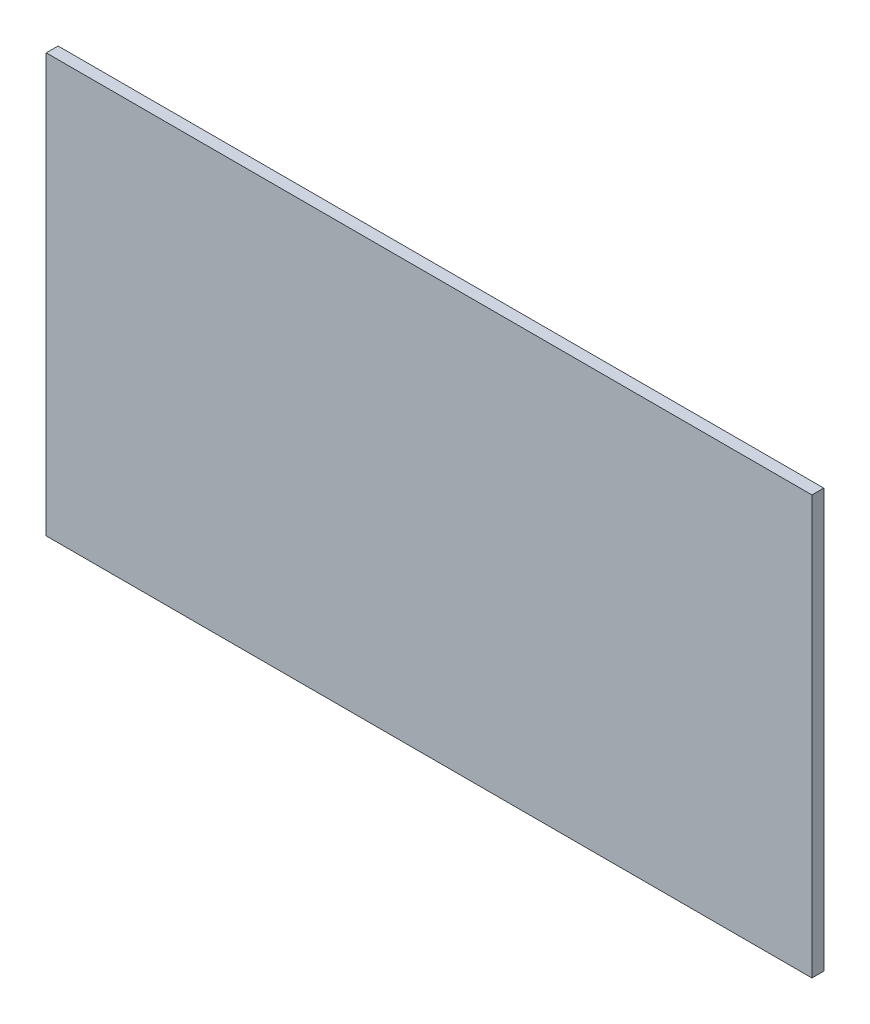
from build123d import *

# Parameters (mm, degrees)
SKETCH1_W     = 194
SKETCH1_H     = 106
PROFILE_DEPTH = 3


with BuildPart() as part:
    # Sketch1 → Profile (new body)
    with BuildSketch(Plane.XY):
        with Locations((97, 53)):
            Rectangle(SKETCH1_W, SKETCH1_H)
    extrude(amount=PROFILE_DEPTH)


solid = part.part
